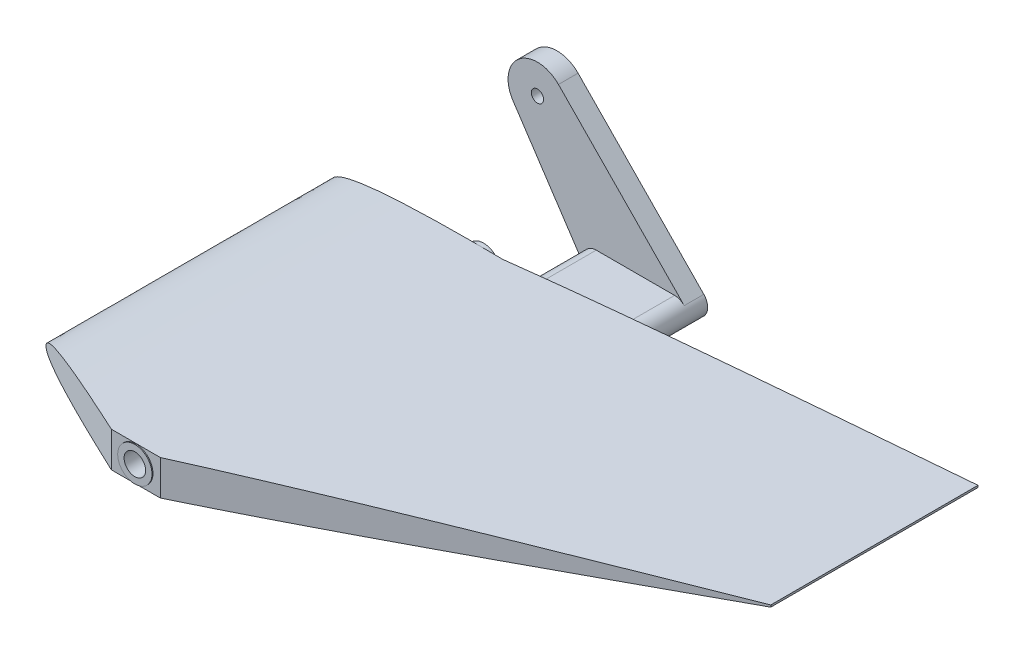
from build123d import *

# Parameters (mm, degrees)
BOSS_EXTRUDE1_DEPTH     = 50
CUT_EXTRUDE1_DEPTH      = 68.292354146
CUT_EXTRUDE1_DEPTH_BACK = 68.292354146
SKETCH3_R               = 1.75
BOSS_EXTRUDE2_DEPTH     = 0.1
BOSS_EXTRUDE3_START     = 0.5
SKETCH5_R               = 1.75
BOSS_EXTRUDE3_DEPTH     = 0.5
SKETCH4_R               = 1.1
CUT_EXTRUDE2_DEPTH      = 61.952851438
BOSS_EXTRUDE4_REACH     = 62.971
BOSS_EXTRUDE5_START     = 2
BOSS_EXTRUDE5_DEPTH     = 2
SKETCH8_R               = 0.625
CUT_EXTRUDE3_DEPTH      = 65.090580501


with BuildPart() as part:
    # Sketch1 → Boss-Extrude1 (new body)
    with BuildSketch(Plane.XY):
        with BuildLine():
            Line((-15, 0), (44.999916667, 0))
            Line((44.999916667, 0), (44.999916667, 0.1))
            add(Edge.make_bspline(
                [(-15, 0), (-15, 3.230995927), (19.077066257, 1.403070244), (44.999916667, 0.1)],
                knots=[0, 0, 0, 0, 1, 1, 1, 1], degree=3))
        make_face()
    boss_extrude1 = extrude(amount=BOSS_EXTRUDE1_DEPTH)

    # Mirror1: Boss-Extrude1 across plane
    add(boss_extrude1.mirror(Plane(origin=(-15, 0, 50), x_dir=(0, 0, 1), z_dir=(0, 1, 0))))

    # Sketch2 → Cut-Extrude1 (cut, two sides: drawn at the far end of the back side and taken through both)
    with BuildSketch(Plane(origin=(0, 0, 0), x_dir=(1, 0, 0), z_dir=(0, 1, 0)).offset(-CUT_EXTRUDE1_DEPTH_BACK)):
        Polygon((-26.522782457, -38.79799257), (-2.5, -50), (2.5, -50), (51.792235583, -27.01465306), (51.792235583, -55.115877471), (-26.522782457, -55.115877471), align=None)
        Polygon((-2.5, -15), (2.5, -15), (50.354863493, -8.27443754), (50.354863493, 7.109448332), (-22.823153077, 7.109448332), (-22.823153077, -15), align=None)
    extrude(amount=CUT_EXTRUDE1_DEPTH + CUT_EXTRUDE1_DEPTH_BACK, mode=Mode.SUBTRACT)

    # Sketch3 → Boss-Extrude2 (add)
    with BuildSketch(Plane.XY.offset(50)):
        Circle(SKETCH3_R)
    extrude(amount=BOSS_EXTRUDE2_DEPTH)

    # Sketch5 → Boss-Extrude3 (add)
    with BuildSketch(Plane(origin=(0, 0, 15), x_dir=(-1, 0, 0), z_dir=(0, 0, -1)).offset(BOSS_EXTRUDE3_START)):
        with Locations(Location((0, 0, 0), (0, 0, 180))):
            Circle(SKETCH5_R)
    extrude(amount=-BOSS_EXTRUDE3_DEPTH)

    # Sketch4 → Cut-Extrude2 (cut, through all)
    with BuildSketch(Plane.XY.offset(50.1)):
        Circle(SKETCH4_R)
    extrude(amount=-CUT_EXTRUDE2_DEPTH, mode=Mode.SUBTRACT)

    # Boss-Extrude4: up to this plane
    boss_extrude4_end = Plane(origin=(50.354863493, -1.966265525, 8.27443754), z_dir=(0.13917310096005872, 0, 0.9902680687415713))
    # Sketch6 → Boss-Extrude4 (add, up to the surface)
    with BuildSketch(Plane(origin=(0, 0, 9), x_dir=(-1, 0, 0), z_dir=(0, 0, -1)), mode=Mode.PRIVATE) as boss_extrude4_sk1:
        with BuildLine():
            Line((-6, -1.375), (-14, -1.375))
            ThreePointArc((-14, -1.375), (-15.375, 0), (-14, 1.375))
            Line((-14, 1.375), (-6, 1.375))
            ThreePointArc((-6, 1.375), (-4.625, 0), (-6, -1.375))
        make_face()
    boss_extrude4_tool1 = split(extrude(boss_extrude4_sk1.sketch, amount=-BOSS_EXTRUDE4_REACH, mode=Mode.PRIVATE), bisect_by=boss_extrude4_end, keep=Keep.BOTH, mode=Mode.PRIVATE)
    add(boss_extrude4_tool1.solids().sort_by_distance((10, 0, 9))[0])

    # Sketch7 → Boss-Extrude5 (add)
    with BuildSketch(Plane(origin=(0, 0, 9), x_dir=(-1, 0, 0), z_dir=(0, 0, -1)).offset(BOSS_EXTRUDE5_START)):
        with BuildLine():
            Line((-4.853696051, -0.759349891), (2.501026797, 10.343236601))
            ThreePointArc((2.501026797, 10.343236601), (1.885205071, 14.333667037), (-2.145513036, 14.096848543))
            Line((-2.145513036, 14.096848543), (-14.983360142, 0.961055582))
            ThreePointArc((-14.983360142, 0.961055582), (-15.26729563, -0.533466763), (-14, -1.375))
            Line((-14, -1.375), (-6, -1.375))
            ThreePointArc((-6, -1.375), (-5.34941607, -1.211348649), (-4.853696051, -0.759349891))
        make_face()
    extrude(amount=-BOSS_EXTRUDE5_DEPTH)

    # Sketch8 → Cut-Extrude3 (cut, through all)
    with BuildSketch(Plane(origin=(0, 0, 7), x_dir=(-1, 0, 0), z_dir=(0, 0, -1))):
        with Locations((0, 12)):
            Circle(SKETCH8_R)
    extrude(amount=-CUT_EXTRUDE3_DEPTH, mode=Mode.SUBTRACT)


solid = part.part
